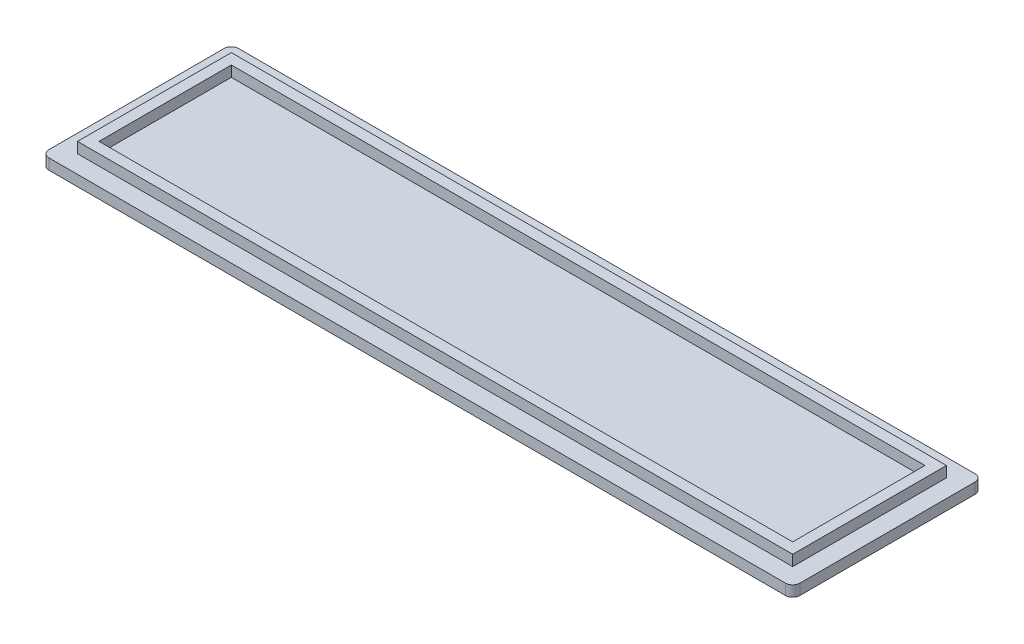
from build123d import *

# Parameters (mm, degrees)
SKETCH_228_W        = 210
SKETCH_228_H        = 53
EXTRUDE_1_DEPTH     = 50
SKETCH_3_W          = 200
SKETCH_3_H          = 43
CUT_EXTRUDE_1_DEPTH = 45
SKETCH_4_R          = 3.5
EXTRUDE_2_DEPTH     = 2
EXTRUDE_2_TAPER     = 1
FILLET_2_R          = 0.5
SKETCH_4_5_R        = 3.5
EXTRUDE_3_DEPTH     = 2
SKETCH_4_6_R        = 3.5
EXTRUDE_4_DEPTH     = 2
SKETCH_4_7_R        = 3.5
EXTRUDE_5_DEPTH     = 2
FILLET_3_R          = 0.5
FILLET_4_R          = 0.5
FILLET_5_R          = 0.5
SKETCH_7_R          = 6
CUT_EXTRUDE_2_DEPTH = 14
CUT_EXTRUDE_2_DRAFT = -5
FILLET_6_R          = 2
SKETCH_8_R          = 7
EXTRUDE_6_DEPTH     = 7
EXTRUDE_6_TAPER     = 5
SKETCH_9_R          = 5.15
CUT_EXTRUDE_3_DEPTH = 7
CUT_EXTRUDE_3_DRAFT = 5
SKETCH_10_W         = 29.4
SKETCH_10_H         = 26.3
CUT_EXTRUDE_4_DEPTH = 5
SKETCH_13_W         = 39.2
SKETCH_13_H         = 27.5
CUT_EXTRUDE_5_DEPTH = 2
SKETCH_14_W         = 6
SKETCH_14_H         = 6
CUT_EXTRUDE_6_DEPTH = 5
FILLET_7_R          = 2
EXTRUDE_8_DEPTH     = 3
SKETCH_18_W         = 200
SKETCH_18_H         = 43
SKETCH_18_W_2       = 194
SKETCH_18_H_2       = 37
EXTRUDE_4681_DEPTH  = 3
SKETCH_21_W         = 4.1
SKETCH_21_H         = 2.2
CUT_EXTRUDE_7_DEPTH = 3


with BuildPart() as part:
    # Sketch 228 → Бобышка-Вытянуть1 (new body)
    with BuildSketch(Plane(origin=(0, 0, 0), x_dir=(1, 0, 0), z_dir=(0, 1, 0))):
        Rectangle(SKETCH_228_W, SKETCH_228_H)
    extrude(amount=EXTRUDE_1_DEPTH)

    # Эскиз3 → Вырез-Вытянуть1 (cut)
    with BuildSketch(Plane.XZ):
        Rectangle(SKETCH_3_W, SKETCH_3_H)
    extrude(amount=-CUT_EXTRUDE_1_DEPTH, mode=Mode.SUBTRACT)

    # Эскиз4 → Бобышка-Вытянуть2 (add)
    with BuildSketch(Plane(origin=(0, 50, 0), x_dir=(1, 0, 0), z_dir=(0, 1, 0))):
        with Locations((98, 19.5)):
            Circle(SKETCH_4_R)
    extrude(amount=EXTRUDE_2_DEPTH, taper=EXTRUDE_2_TAPER)

    # Скругление2
    fillet_2_edges = [part.edges().sort_by_distance(p)[0] for p in [
        (94.53491013, 52, -19.5),
    ]]
    fillet(fillet_2_edges, radius=FILLET_2_R)

    # Эскиз4<5> → Бобышка-Вытянуть3 (add)
    with BuildSketch(Plane(origin=(0, 50, 0), x_dir=(1, 0, 0), z_dir=(0, 1, 0))):
        with Locations(Location((98, -19.5, 0), (0, 0, 90))):
            Circle(SKETCH_4_5_R)
    extrude(amount=EXTRUDE_3_DEPTH)

    # Эскиз4<6> → Бобышка-Вытянуть4 (add)
    with BuildSketch(Plane(origin=(0, 50, 0), x_dir=(1, 0, 0), z_dir=(0, 1, 0))):
        with Locations(Location((-98, -19.5, 0), (0, 0, 270))):
            Circle(SKETCH_4_6_R)
    extrude(amount=EXTRUDE_4_DEPTH)

    # Эскиз4<7> → Бобышка-Вытянуть5 (add)
    with BuildSketch(Plane(origin=(0, 50, 0), x_dir=(1, 0, 0), z_dir=(0, 1, 0))):
        with Locations(Location((-98, 19.5, 0), (0, 0, 90))):
            Circle(SKETCH_4_7_R)
    extrude(amount=EXTRUDE_5_DEPTH)

    # Скругление3
    fillet_3_edges = [part.edges().sort_by_distance(p)[0] for p in [
        (-98, 52, 16),
    ]]
    fillet(fillet_3_edges, radius=FILLET_3_R)

    # Скругление4
    fillet_4_edges = [part.edges().sort_by_distance(p)[0] for p in [
        (-98, 52, -16),
    ]]
    fillet(fillet_4_edges, radius=FILLET_4_R)

    # Скругление5
    fillet_5_edges = [part.edges().sort_by_distance(p)[0] for p in [
        (98, 52, 23),
    ]]
    fillet(fillet_5_edges, radius=FILLET_5_R)


with BuildPart() as cut_extrude_2_tool:
    # Эскиз7 → Вырез-Вытянуть2 (with draft: the straight prism first)
    with BuildSketch(Plane(origin=(0, 0, -26.5), x_dir=(-1, 0, 0), z_dir=(0, 0, -1))):
        with Locations((0, 35.081888724)):
            Circle(SKETCH_7_R)
    extrude(amount=-CUT_EXTRUDE_2_DEPTH)
    # Вырез-Вытянуть2: the draft: its side faces are tilted about the plane it starts from
    cut_extrude_2_sides = [cut_extrude_2_tool.faces().sort_by_distance(p)[0] for p in [
        (6, 35.081888724, -19.5),
    ]]
    draft(cut_extrude_2_sides, Plane(origin=(0, 0, -26.5), x_dir=(-1, 0, 0), z_dir=(0, 0, -1)), CUT_EXTRUDE_2_DRAFT)


with BuildPart() as part_1:
    add(part.part)

    # Вырез-Вытянуть2: cut by cut_extrude_2_tool
    add(cut_extrude_2_tool.part, mode=Mode.SUBTRACT)

    # Скругление6
    fillet_6_edges = [part_1.edges().sort_by_distance(p)[0] for p in [
        (6, 35.081888724, -26.5),
    ]]
    fillet(fillet_6_edges, radius=FILLET_6_R)

    # Эскиз8 → Бобышка-Вытянуть6 (add)
    with BuildSketch(Plane.XY.offset(-21.5)):
        with Locations((0, 35.081888724)):
            Circle(SKETCH_8_R)
    extrude(amount=EXTRUDE_6_DEPTH, taper=EXTRUDE_6_TAPER)


with BuildPart() as cut_extrude_3_tool:
    # Эскиз9 → Вырез-Вытянуть3 (with draft: the straight prism first)
    with BuildSketch(Plane.XY.offset(-14.5)):
        with Locations((0, 35.081888724)):
            Circle(SKETCH_9_R)
    extrude(amount=-CUT_EXTRUDE_3_DEPTH)
    # Вырез-Вытянуть3: the draft: its side faces are tilted about the plane it starts from
    cut_extrude_3_sides = [cut_extrude_3_tool.faces().sort_by_distance(p)[0] for p in [
        (-5.15, 35.081888724, -18),
    ]]
    draft(cut_extrude_3_sides, Plane.XY.offset(-14.5), CUT_EXTRUDE_3_DRAFT)


with BuildPart() as part_2:
    add(part_1.part)

    # Вырез-Вытянуть3: cut by cut_extrude_3_tool
    add(cut_extrude_3_tool.part, mode=Mode.SUBTRACT)

    # Эскиз10 → Вырез-Вытянуть4 (cut)
    with BuildSketch(Plane.XY.offset(26.5)):
        with Locations((-50, 25)):
            Rectangle(SKETCH_10_W, SKETCH_10_H)
    extrude(amount=-CUT_EXTRUDE_4_DEPTH, mode=Mode.SUBTRACT)

    # Эскиз13 → Вырез-Вытянуть5 (cut)
    with BuildSketch(Plane(origin=(0, 0, 21.5), x_dir=(-1, 0, 0), z_dir=(0, 0, -1))):
        with Locations((50, 25)):
            Rectangle(SKETCH_13_W, SKETCH_13_H)
    extrude(amount=-CUT_EXTRUDE_5_DEPTH, mode=Mode.SUBTRACT)

    # Эскиз14 → Вырез-Вытянуть6 (cut)
    with BuildSketch(Plane.XY.offset(26.5)):
        with Locations((-76.5, 31.8)):
            Rectangle(SKETCH_14_W, SKETCH_14_H)
        with Locations((-76.5, 18.2)):
            Rectangle(SKETCH_14_W, SKETCH_14_H)
    extrude(amount=-CUT_EXTRUDE_6_DEPTH, mode=Mode.SUBTRACT)

    # Скругление7
    fillet_7_edges = [part_2.edges().sort_by_distance(p)[0] for p in [
        (-105, 50, 0),
        (0, 50, 26.5),
        (105, 50, 0),
        (105, 25, 26.5),
        (-105, 25, 26.5),
        (-105, 25, -26.5),
        (105, 25, -26.5),
        (0, 50, -26.5),
    ]]
    fillet(fillet_7_edges, radius=FILLET_7_R)


with BuildPart() as body_2:
    # Эскиз17 → Бобышка-Вытянуть8 (new body)
    with BuildSketch(Plane.XZ):
        with BuildLine():
            Line((-105, 24.5), (-105, -24.5))
            ThreePointArc((-105, -24.5), (-104.414213562, -25.914213562), (-103, -26.5))
            Line((-103, -26.5), (103, -26.5))
            ThreePointArc((103, -26.5), (104.414213562, -25.914213562), (105, -24.5))
            Line((105, -24.5), (105, 24.5))
            ThreePointArc((105, 24.5), (104.414213562, 25.914213562), (103, 26.5))
            Line((103, 26.5), (-103, 26.5))
            ThreePointArc((-103, 26.5), (-104.414213562, 25.914213562), (-105, 24.5))
        make_face()
    extrude(amount=EXTRUDE_8_DEPTH)

    # Эскиз18 → Extrude 4681 (add)
    with BuildSketch(Plane(origin=(0, 0, 0), x_dir=(1, 0, 0), z_dir=(0, 1, 0))):
        Rectangle(SKETCH_18_W, SKETCH_18_H)
        Rectangle(SKETCH_18_W_2, SKETCH_18_H_2, mode=Mode.SUBTRACT)
    extrude(amount=EXTRUDE_4681_DEPTH)

    # Эскиз21 → Вырез-Вытянуть7 (cut)
    with BuildSketch(Plane.XZ.offset(3)):
        with Locations((10.5, 16.9)):
            Rectangle(SKETCH_21_W, SKETCH_21_H)
        with Locations((18.5, 16.9)):
            Rectangle(SKETCH_21_W, SKETCH_21_H)
    extrude(amount=-CUT_EXTRUDE_7_DEPTH, mode=Mode.SUBTRACT)


solid = body_2.part
